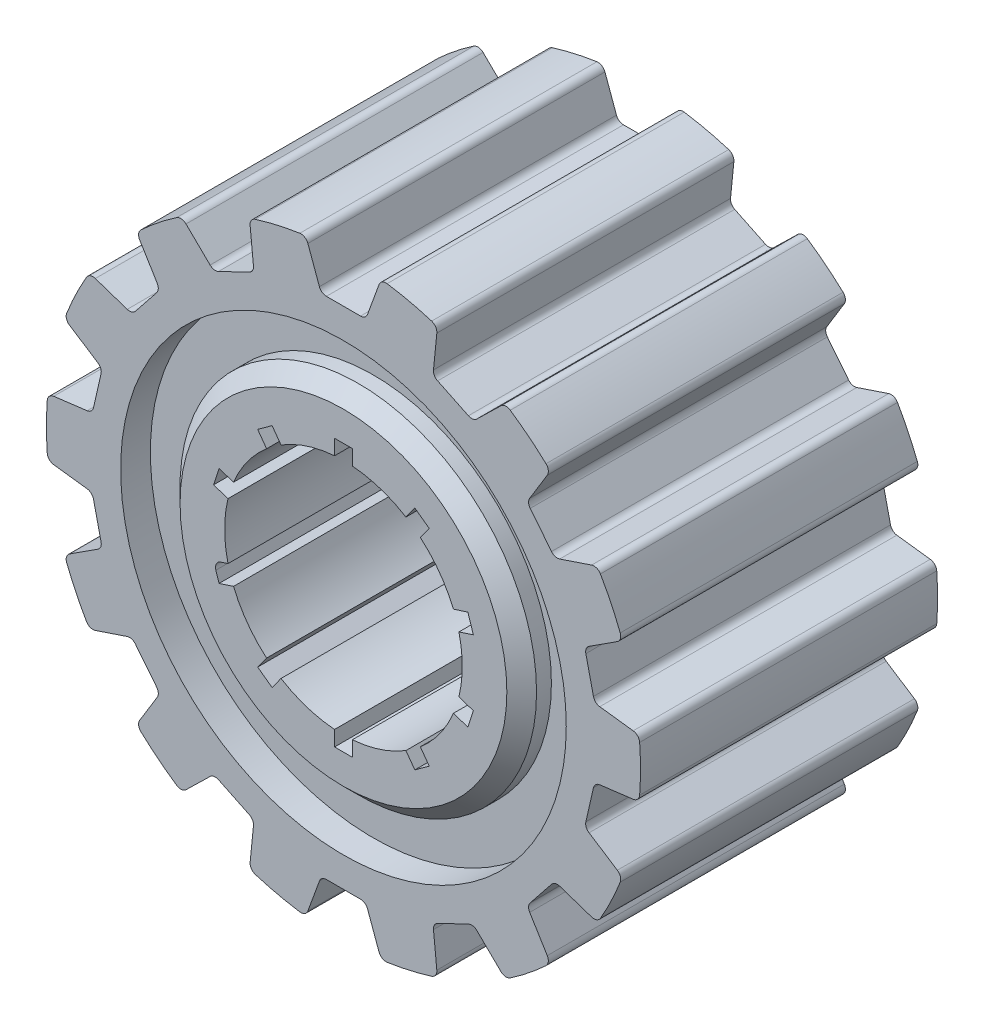
from build123d import *

# Parameters (mm, degrees)
SKETCH1_R           = 10
BOSS_EXTRUDE1_DEPTH = 10
CUT_EXTRUDE1_DEPTH  = 18.320508076
CIRPATTERN1_COUNT   = 14
CUT_EXTRUDE2_START  = -4
SKETCH3_R           = 7.5
SKETCH3_R_2         = 6
CUT_EXTRUDE2_DEPTH  = 11.946425093
CHAMFER1_SIZE       = 0.5
CHAMFER2_SIZE       = 0.5
FILLET1_R           = 0.25


with BuildPart() as part:
    # Sketch1 → Boss-Extrude1 (new body)
    with BuildSketch(Plane.XY):
        Circle(SKETCH1_R)
        with BuildLine():
            ThreePointArc((-3.700806493, -1.517903589), (-3.236067977, -2.351141009), (-2.587224198, -3.050618126))
            Line((-2.587224198, -3.050618126), (-2.887738734, -3.464240899))
            Line((-2.887738734, -3.464240899), (-2.402328537, -3.81691205))
            Line((-2.402328537, -3.81691205), (-2.101814002, -3.403289277))
            ThreePointArc((-2.101814002, -3.403289277), (-1.236067977, -3.804226065), (-0.3, -3.988734135))
            Line((-0.3, -3.988734135), (-0.3, -4.5))
            Line((-0.3, -4.5), (0.3, -4.5))
            Line((0.3, -4.5), (0.3, -3.988734135))
            ThreePointArc((0.3, -3.988734135), (1.236067977, -3.804226065), (2.101814002, -3.403289277))
            Line((2.101814002, -3.403289277), (2.402328537, -3.81691205))
            Line((2.402328537, -3.81691205), (2.887738734, -3.464240899))
            Line((2.887738734, -3.464240899), (2.587224198, -3.050618126))
            ThreePointArc((2.587224198, -3.050618126), (3.236067977, -2.351141009), (3.700806493, -1.517903589))
            Line((3.700806493, -1.517903589), (4.187049225, -1.67589343))
            Line((4.187049225, -1.67589343), (4.372459422, -1.10525952))
            Line((4.372459422, -1.10525952), (3.886216689, -0.947269679))
            ThreePointArc((3.886216689, -0.947269679), (4, 0), (3.886216689, 0.947269679))
            Line((3.886216689, 0.947269679), (4.372459422, 1.10525952))
            Line((4.372459422, 1.10525952), (4.187049225, 1.67589343))
            Line((4.187049225, 1.67589343), (3.700806493, 1.517903589))
            ThreePointArc((3.700806493, 1.517903589), (3.236067977, 2.351141009), (2.587224198, 3.050618126))
            Line((2.587224198, 3.050618126), (2.887738734, 3.464240899))
            Line((2.887738734, 3.464240899), (2.402328537, 3.81691205))
            Line((2.402328537, 3.81691205), (2.101814002, 3.403289277))
            ThreePointArc((2.101814002, 3.403289277), (1.236067977, 3.804226065), (0.3, 3.988734135))
            Line((0.3, 3.988734135), (0.3, 4.5))
            Line((0.3, 4.5), (-0.3, 4.5))
            Line((-0.3, 4.5), (-0.3, 3.988734135))
            ThreePointArc((-0.3, 3.988734135), (-1.236067977, 3.804226065), (-2.101814002, 3.403289277))
            Line((-2.101814002, 3.403289277), (-2.402328537, 3.81691205))
            Line((-2.402328537, 3.81691205), (-2.887738734, 3.464240899))
            Line((-2.887738734, 3.464240899), (-2.587224198, 3.050618126))
            ThreePointArc((-2.587224198, 3.050618126), (-3.236067977, 2.351141009), (-3.700806493, 1.517903589))
            Line((-3.700806493, 1.517903589), (-4.187049225, 1.67589343))
            Line((-4.187049225, 1.67589343), (-4.372459422, 1.10525952))
            Line((-4.372459422, 1.10525952), (-3.886216689, 0.947269679))
            ThreePointArc((-3.886216689, 0.947269679), (-4, 0), (-3.886216689, -0.947269679))
            Line((-3.886216689, -0.947269679), (-4.372459422, -1.10525952))
            Line((-4.372459422, -1.10525952), (-4.187049225, -1.67589343))
            Line((-4.187049225, -1.67589343), (-3.700806493, -1.517903589))
        make_face(mode=Mode.SUBTRACT)
    extrude(amount=BOSS_EXTRUDE1_DEPTH)

    # Sketch2 → Cut-Extrude1 (cut, through all)
    with BuildSketch(Plane.XY.offset(10)):
        with BuildLine():
            Line((-0.75, 8.5), (0, 8.5))
            Line((0, 8.5), (0, 10))
            ThreePointArc((0, 10), (-0.634599116, 9.979843885), (-1.266640021, 9.919456792))
            Line((-1.266640021, 9.919456792), (-0.75, 8.5))
        make_face()
        with BuildLine():
            Line((0, 10), (0, 8.5))
            Line((0, 8.5), (0.75, 8.5))
            Line((0.75, 8.5), (1.266640021, 9.919456792))
            ThreePointArc((1.266640021, 9.919456792), (0.634599116, 9.979843885), (0, 10))
        make_face()
    cut_extrude1 = extrude(amount=-CUT_EXTRUDE1_DEPTH, mode=Mode.SUBTRACT)

    # CirPattern1: Cut-Extrude1 ×14 about axis
    cirpattern1_axis = Axis((0, 0, 0), (0, 0, 1))
    for i in range(1, CIRPATTERN1_COUNT):
        add(cut_extrude1.rotate(cirpattern1_axis, i * 360 / CIRPATTERN1_COUNT), mode=Mode.SUBTRACT)

    # Sketch3 → Cut-Extrude2 (cut, through all)
    with BuildSketch(Plane.XY.offset(5).offset(CUT_EXTRUDE2_START)):
        Circle(SKETCH3_R)
        Circle(SKETCH3_R_2, mode=Mode.SUBTRACT)
    cut_extrude2 = extrude(amount=-CUT_EXTRUDE2_DEPTH, mode=Mode.SUBTRACT)

    # Chamfer1
    chamfer1_edges = [part.edges().sort_by_distance(p)[0] for p in [
        (-6, 0, 0),
    ]]
    chamfer(chamfer1_edges, length=CHAMFER1_SIZE)

    # Mirror2: Cut-Extrude2 across plane
    add(cut_extrude2.mirror(Plane.XY.offset(5)), mode=Mode.SUBTRACT)

    # Chamfer2
    chamfer2_edges = [part.edges().sort_by_distance(p)[0] for p in [
        (-6, 0, 10),
    ]]
    chamfer(chamfer2_edges, length=CHAMFER2_SIZE)

    # Fillet1
    fillet1_edges = [part.edges().sort_by_distance(p)[0] for p in [
        (0.75, 8.5, 5),
        (-0.75, 8.5, 5),
        (-1.266640021, 9.919456792, 5),
        (1.266640021, 9.919456792, 5),
        (-8.545080745, 5.194381104, 5),
        (-7.113184952, 4.713289704, 5),
        (-6.17795025, 5.886036928, 5),
        (-6.965606473, 7.174979196, 5),
        (-9.952609221, 0.972404078, 5),
        (-8.453777954, 1.160232004, 5),
        (-8.119996553, 2.622623873, 5),
        (-9.38890138, 3.442169501, 5),
        (-9.38890138, -3.442169501, 5),
        (-8.119996553, -2.622623873, 5),
        (-8.453777954, -1.160232004, 5),
        (-9.952609221, -0.972404078, 5),
        (-6.965606473, -7.174979196, 5),
        (-6.17795025, -5.886036928, 5),
        (-7.113184952, -4.713289704, 5),
        (-8.545080745, -5.194381104, 5),
        (-3.162687777, -9.486696265, 5),
        (-3.012285132, -7.983648182, 5),
        (-4.363738433, -7.332822573, 5),
        (-5.445094229, -8.387547248, 5),
        (1.266640021, -9.919456792, 5),
        (0.75, -8.5, 5),
        (-0.75, -8.5, 5),
        (-1.266640021, -9.919456792, 5),
        (5.445094229, -8.387547248, 5),
        (4.363738433, -7.332822573, 5),
        (3.012285132, -7.983648182, 5),
        (3.162687777, -9.486696265, 5),
        (8.545080745, -5.194381104, 5),
        (7.113184952, -4.713289704, 5),
        (6.17795025, -5.886036928, 5),
        (6.965606473, -7.174979196, 5),
        (9.952609221, -0.972404078, 5),
        (8.453777954, -1.160232004, 5),
        (8.119996553, -2.622623873, 5),
        (9.38890138, -3.442169501, 5),
        (9.38890138, 3.442169501, 5),
        (8.119996553, 2.622623873, 5),
        (8.453777954, 1.160232004, 5),
        (9.952609221, 0.972404078, 5),
        (6.965606473, 7.174979196, 5),
        (6.17795025, 5.886036928, 5),
        (7.113184952, 4.713289704, 5),
        (8.545080745, 5.194381104, 5),
        (3.162687777, 9.486696265, 5),
        (3.012285132, 7.983648182, 5),
        (4.363738433, 7.332822573, 5),
        (5.445094229, 8.387547248, 5),
        (-5.445094229, 8.387547248, 5),
        (-4.363738433, 7.332822573, 5),
        (-3.012285132, 7.983648182, 5),
        (-3.162687777, 9.486696265, 5),
        (-4.372459422, -1.10525952, 5),
    ]]
    fillet(fillet1_edges, radius=FILLET1_R)


solid = part.part
